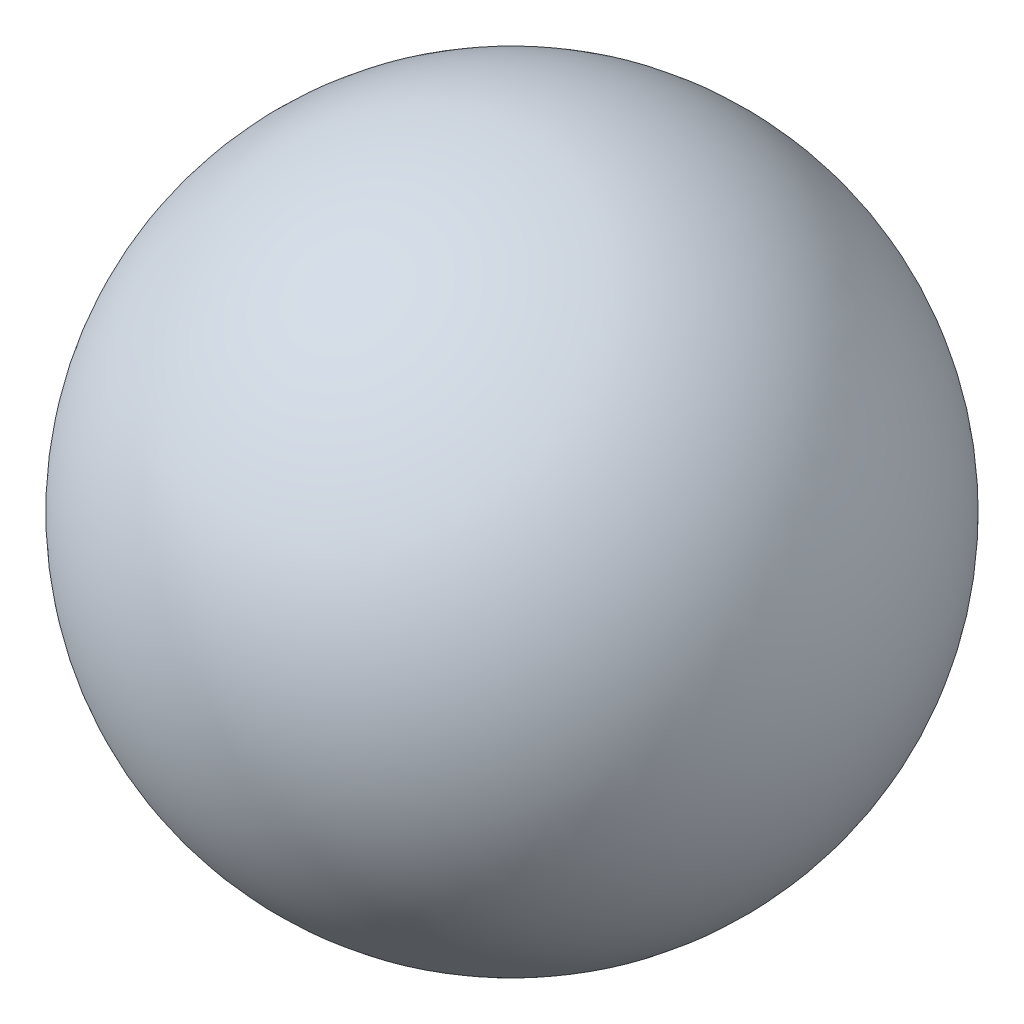
from build123d import *


with BuildPart() as part:
    # Esquisse1 → Révolution7 (revolve)
    with BuildSketch(Plane.XY):
        with BuildLine():
            Line((0, -25), (0, 25))
            ThreePointArc((0, 25), (-25, 0), (0, -25))
        make_face()
    revolve(axis=Axis((0, -25, 0), (0, 1, 0)))


solid = part.part
